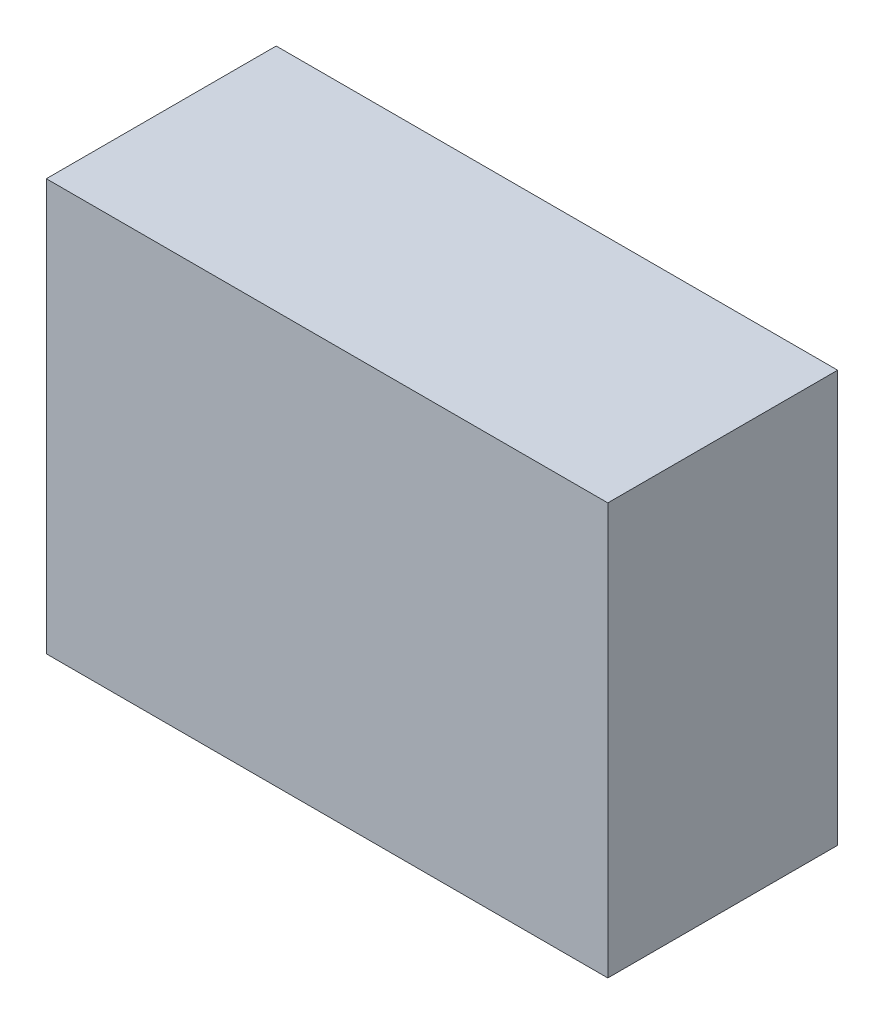
from build123d import *

# Parameters (mm, degrees)
SKETCH1_W      = 64
SKETCH1_H      = 46.9
ENVELOPE_DEPTH = 26.2


with BuildPart() as part:
    # Sketch1 → Envelope (new body)
    with BuildSketch(Plane.XY):
        Rectangle(SKETCH1_W, SKETCH1_H)
    extrude(amount=ENVELOPE_DEPTH)


solid = part.part
